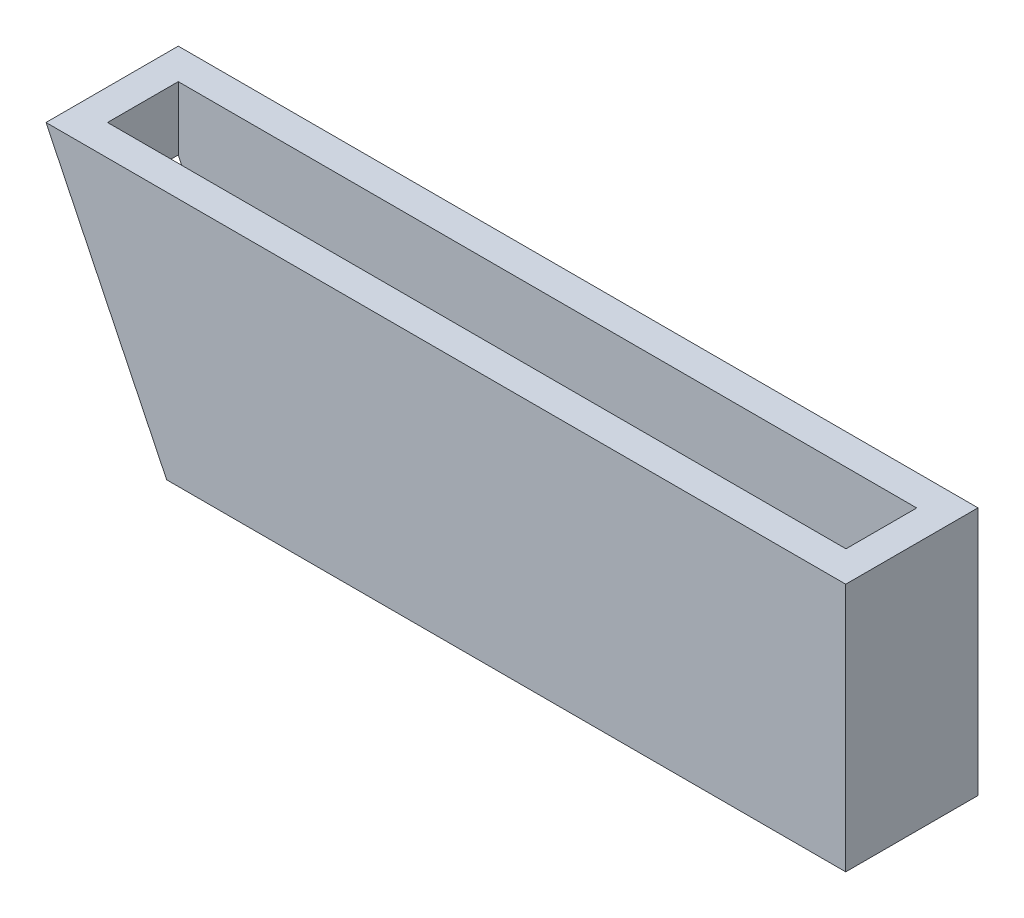
from build123d import *

# Parameters (mm, degrees)
ESQUISSE5_W                  = 10
ESQUISSE5_H                  = 23
ESQUISSE5_W_2                = 260
ESQUISSE5_H_2                = 10
ESQUISSE5_W_3                = 9.9238066
BOSS_EXTRU_4_DEPTH           = 81
ENL_V_MAT_EXTRU_2_DEPTH      = 2
ENL_V_MAT_EXTRU_2_DEPTH_BACK = 227


with BuildPart() as part:
    # Esquisse5 → Boss.-Extru.4 (new body)
    with BuildSketch(Plane(origin=(0, 0, 0), x_dir=(1, 0, 0), z_dir=(0, 1, 0))):
        Polygon((0, 32.998552378), (0, 23), (10, 23), (250.0761934, 23), (260, 23), (260, 32.998552378), align=None)
        with Locations((5, 11.5)):
            Rectangle(ESQUISSE5_W, ESQUISSE5_H)
        with Locations((130, -5)):
            Rectangle(ESQUISSE5_W_2, ESQUISSE5_H_2)
        with Locations((255.0380967, 11.5)):
            Rectangle(ESQUISSE5_W_3, ESQUISSE5_H)
    extrude(amount=BOSS_EXTRU_4_DEPTH)

    # Esquisse7 → Enlèv. mat.-Extru.2 (cut, two sides: drawn at the far end of the back side and taken through both)
    with BuildSketch(Plane(origin=(0, 0, -32.998552378), x_dir=(-1, 0, 0), z_dir=(0, 0, -1)).offset(-ENL_V_MAT_EXTRU_2_DEPTH_BACK)):
        Polygon((0, 0), (0, 81), (-39.230090492, 0), align=None)
    extrude(amount=ENL_V_MAT_EXTRU_2_DEPTH + ENL_V_MAT_EXTRU_2_DEPTH_BACK, mode=Mode.SUBTRACT)


solid = part.part
